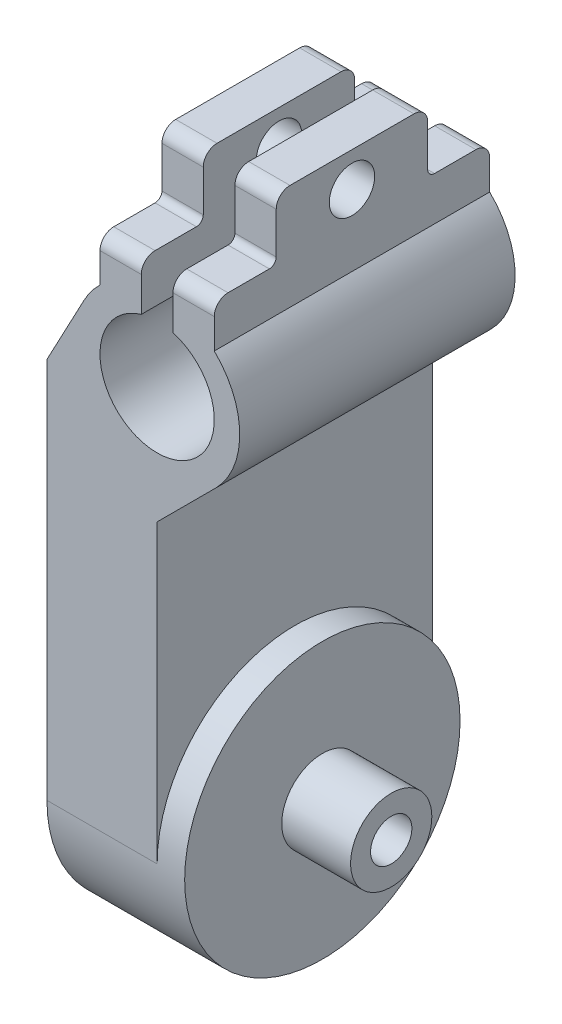
from build123d import *

# Parameters (mm, degrees)
EXTRUDE_1_DEPTH             = 10
EXTRUDE_2_REACH             = 34.619
SKETCH_2_R                  = 10
EXTRUDE_2_DIRECTION_2_DEPTH = 2
SKETCH_4_R                  = 2.95
EXTRUDE_3_DEPTH             = 5
SKETCH_5_R                  = 1.5
CUT_EXTRUDE_1_DEPTH         = 44.874821937
SKETCH_6_R                  = 1.65
SKETCH_6_W                  = 14.704506527
SKETCH_6_H                  = 8.520368268
CUT_EXTRUDE_2_DEPTH         = 43.983979574
FILLET_1_R                  = 1
FILLET_2_R                  = 0.5


with BuildPart() as part:
    # 草图1 → 凸台-拉伸1 (new, symmetric)
    with BuildSketch(Plane.XY):
        with BuildLine():
            Line((-1.15, 3.987480407), (-1.15, 12))
            Line((-1.15, 12), (-4.15, 12))
            Line((-4.15, 12), (-4.15, 4.333301282))
            ThreePointArc((-4.15, 4.333301282), (-4.784308974, 3.620826928), (-5.297685557, 2.816829377))
            Line((-5.297685557, 2.816829377), (-8, -2.265484914))
            Line((-8, -2.265484914), (-8, -30))
            Line((-8, -30), (0, -30))
            Line((0, -30), (0, -8.485281374))
            Line((0, -8.485281374), (4.242640687, -4.242640687))
            ThreePointArc((4.242640687, -4.242640687), (5.999649956, 0.064810571), (4.15, 4.333301282))
            Line((4.15, 4.333301282), (4.15, 12))
            Line((4.15, 12), (1.15, 12))
            Line((1.15, 12), (1.15, 3.987480407))
            ThreePointArc((1.15, 3.987480407), (0, -4.15), (-1.15, 3.987480407))
        make_face()
    extrude(amount=EXTRUDE_1_DEPTH, both=True)

    # 凸台-拉伸2: up to this face of the body (flat: up to its plane)
    extrude_2_end = Plane(part.part.faces().sort_by_distance((-8, -16.132742457, 0))[0])
    # 草图2 → 凸台-拉伸2 (add, up to the picked face)
    with BuildSketch(Plane(origin=(0, 0, 0), x_dir=(0, 0, -1), z_dir=(1, 0, 0)), mode=Mode.PRIVATE) as extrude_2_sk1:
        with Locations((0, -30)):
            Circle(SKETCH_2_R)
    extrude_2_tool1 = split(extrude(extrude_2_sk1.sketch, amount=-EXTRUDE_2_REACH, mode=Mode.PRIVATE), bisect_by=extrude_2_end, keep=Keep.BOTH, mode=Mode.PRIVATE)
    add(extrude_2_tool1.solids().sort_by(Axis((0, -30, 0), (-1, 0, 0)))[0])

    # 草图2 → 凸台-拉伸2 direction 2 (add)
    with BuildSketch(Plane(origin=(0, 0, 0), x_dir=(0, 0, -1), z_dir=(1, 0, 0))):
        with Locations((0, -30)):
            Circle(SKETCH_2_R)
    extrude(amount=EXTRUDE_2_DIRECTION_2_DEPTH)

    # 草图4 → 凸台-拉伸3 (add)
    with BuildSketch(Plane(origin=(2, 0, 0), x_dir=(0, 0, -1), z_dir=(1, 0, 0))):
        with Locations((0, -30)):
            Circle(SKETCH_4_R)
    extrude(amount=EXTRUDE_3_DEPTH)

    # 草图5 → 切除-拉伸1 (cut, through all)
    with BuildSketch(Plane(origin=(7, 0, 0), x_dir=(0, 0, -1), z_dir=(1, 0, 0))):
        with Locations((0, -30)):
            Circle(SKETCH_5_R)
    extrude(amount=-CUT_EXTRUDE_1_DEPTH, mode=Mode.SUBTRACT)

    # 草图6 → 切除-拉伸2 (cut, through all)
    with BuildSketch(Plane(origin=(4.15, 0, 0), x_dir=(0, 0, -1), z_dir=(1, 0, 0))):
        with Locations(Location((0, 9.5, 0), (0, 0, 90))):
            Circle(SKETCH_6_R)
        with Locations((-12.852253263, 11.760184134)):
            Rectangle(SKETCH_6_W, SKETCH_6_H)
        with Locations((12.852253263, 11.760184134)):
            Rectangle(SKETCH_6_W, SKETCH_6_H)
    extrude(amount=-CUT_EXTRUDE_2_DEPTH, mode=Mode.SUBTRACT)

    # 圆角1
    fillet_1_edges = [part.edges().sort_by_distance(p)[0] for p in [
        (2.65, 7.5, -10),
        (-2.65, 7.5, -10),
        (2.65, 7.5, 10),
        (-2.65, 7.5, 10),
        (2.65, 12, 5.5),
        (-2.65, 12, 5.5),
        (2.65, 12, -5.5),
        (-2.65, 12, -5.5),
    ]]
    fillet(fillet_1_edges, radius=FILLET_1_R)

    # 圆角2
    fillet_2_edges = [part.edges().sort_by_distance(p)[0] for p in [
        (-2.65, 7.5, 5.5),
        (2.65, 7.5, 5.5),
        (2.65, 7.5, -5.5),
        (-2.65, 7.5, -5.5),
    ]]
    fillet(fillet_2_edges, radius=FILLET_2_R)


solid = part.part
